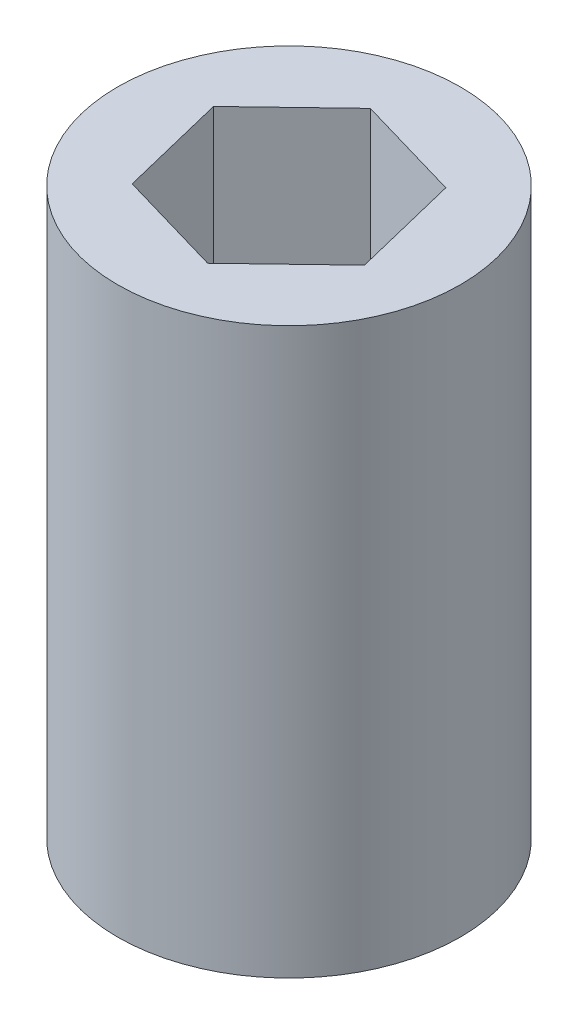
from build123d import *

# Parameters (mm, degrees)
SKETCH1_R           = 4.55
BOSS_EXTRUDE1_DEPTH = 15
CUT_EXTRUDE1_DEPTH  = 15


with BuildPart() as part:
    # Sketch1 → Boss-Extrude1 (new body)
    with BuildSketch(Plane(origin=(0, 0, 0), x_dir=(1, 0, 0), z_dir=(0, 1, 0))):
        with Locations(Location((0, 0, 0), (0, 0, 270))):
            Circle(SKETCH1_R)
    extrude(amount=BOSS_EXTRUDE1_DEPTH)

    # Sketch2 → Cut-Extrude1 (cut)
    with BuildSketch(Plane(origin=(0, 15, 0), x_dir=(1, 0, 0), z_dir=(0, 1, 0))):
        Polygon((-2.126350259, -2.036819721), (0.700762492, -2.859883202), (2.827112751, -0.823063481), (2.126350259, 2.036819721), (-0.700762492, 2.859883202), (-2.827112751, 0.823063481), align=None)
    extrude(amount=-CUT_EXTRUDE1_DEPTH, mode=Mode.SUBTRACT)


solid = part.part
